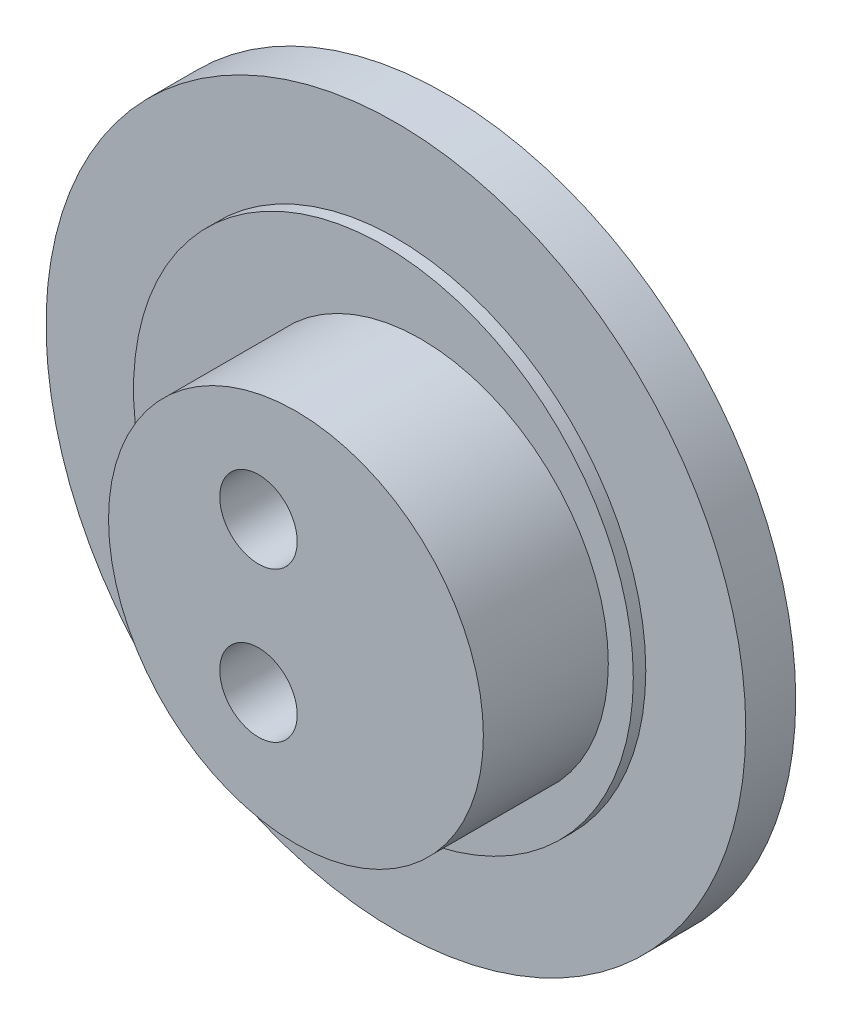
from build123d import *

# Parameters (mm, degrees)
SKETCH1_R           = 10
BOSS_EXTRUDE1_DEPTH = 0.5
SKETCH4_R           = 14
BOSS_EXTRUDE3_DEPTH = 2
SKETCH5_R           = 10
BOSS_EXTRUDE4_DEPTH = 0.5
SKETCH6_R           = 7.5
BOSS_EXTRUDE6_DEPTH = 5
SKETCH7_R           = 1.55
CUT_EXTRUDE1_DEPTH  = 22.354156504


with BuildPart() as part:
    # Sketch1 → Boss-Extrude1 (new body)
    with BuildSketch(Plane.XY):
        Circle(SKETCH1_R)
    extrude(amount=BOSS_EXTRUDE1_DEPTH)

    # Sketch4 → Boss-Extrude3 (add)
    with BuildSketch(Plane.XY.offset(0.5)):
        Circle(SKETCH4_R)
    extrude(amount=BOSS_EXTRUDE3_DEPTH)

    # Sketch5 → Boss-Extrude4 (add)
    with BuildSketch(Plane.XY.offset(2.5)):
        Circle(SKETCH5_R)
    extrude(amount=BOSS_EXTRUDE4_DEPTH)

    # Sketch6 → Boss-Extrude6 (add)
    with BuildSketch(Plane.XY.offset(3)):
        with Locations((1.5, 0)):
            Circle(SKETCH6_R)
    extrude(amount=BOSS_EXTRUDE6_DEPTH)

    # Sketch7 → Cut-Extrude1 (cut, through all)
    with BuildSketch(Plane.XY.offset(8)):
        with Locations((0, 3)):
            Circle(SKETCH7_R)
        with Locations(Location((0, -3, 0), (0, 0, 180))):
            Circle(SKETCH7_R)
    extrude(amount=-CUT_EXTRUDE1_DEPTH, mode=Mode.SUBTRACT)


solid = part.part
